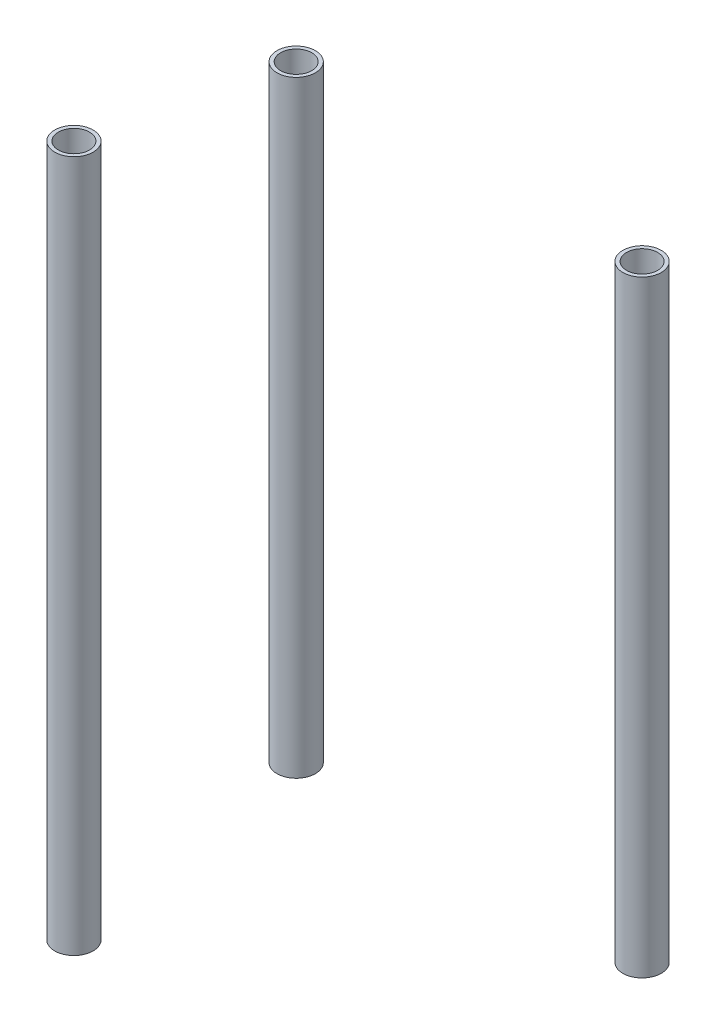
from build123d import *

# Parameters (mm, degrees)
SKETCH173_R                                    = 12.7
SKETCH173_R_2                                  = 10.287
OTHER_REAR_STRUCTURAL_TUBING_1_00_X_0_04_DEPTH = 457.2
SKETCH173_ON_SEGMENT_2_R                       = 12.7
SKETCH173_ON_SEGMENT_2_R_2                     = 10.287
OTHER_REAR_STRUCTURAL_TUBING_1_00_X_2_DEPTH    = 401.1676
SKETCH173_ON_SEGMENT_3_R                       = 12.7
SKETCH173_ON_SEGMENT_3_R_2                     = 10.287
OTHER_REAR_STRUCTURAL_TUBING_1_00_X_3_DEPTH    = 401.1676


with BuildPart() as part:
    # Sketch173 → other rear structural tubing 1.00 X 0.049IN(1) (new body)
    with BuildSketch(Plane(origin=(-696.777536969, -228.6, 162.56), x_dir=(0, 0, -1), z_dir=(0, 1, 0))):
        Circle(SKETCH173_R)
        Circle(SKETCH173_R_2, mode=Mode.SUBTRACT)
    extrude(amount=OTHER_REAR_STRUCTURAL_TUBING_1_00_X_0_04_DEPTH)


with BuildPart() as body_2:
    # Sketch173 on segment 2 (carried to segment 2) → other rear structural tubing 1.00 X  2 (new body)
    with BuildSketch(Plane(origin=(-468.177536969, -200.5838, 15.6718), x_dir=(0, 0, -1), z_dir=(0, 1, 0))):
        Circle(SKETCH173_ON_SEGMENT_2_R)
        Circle(SKETCH173_ON_SEGMENT_2_R_2, mode=Mode.SUBTRACT)
    extrude(amount=OTHER_REAR_STRUCTURAL_TUBING_1_00_X_2_DEPTH)


with BuildPart() as body_3:
    # Sketch173 on segment 3 (carried to segment 3) → other rear structural tubing 1.00 X  3 (new body)
    with BuildSketch(Plane(origin=(-696.777536969, -200.5838, 15.6718), x_dir=(0, 0, -1), z_dir=(0, 1, 0))):
        Circle(SKETCH173_ON_SEGMENT_3_R)
        Circle(SKETCH173_ON_SEGMENT_3_R_2, mode=Mode.SUBTRACT)
    extrude(amount=OTHER_REAR_STRUCTURAL_TUBING_1_00_X_3_DEPTH)


solid = Compound([part.part, body_2.part, body_3.part])
